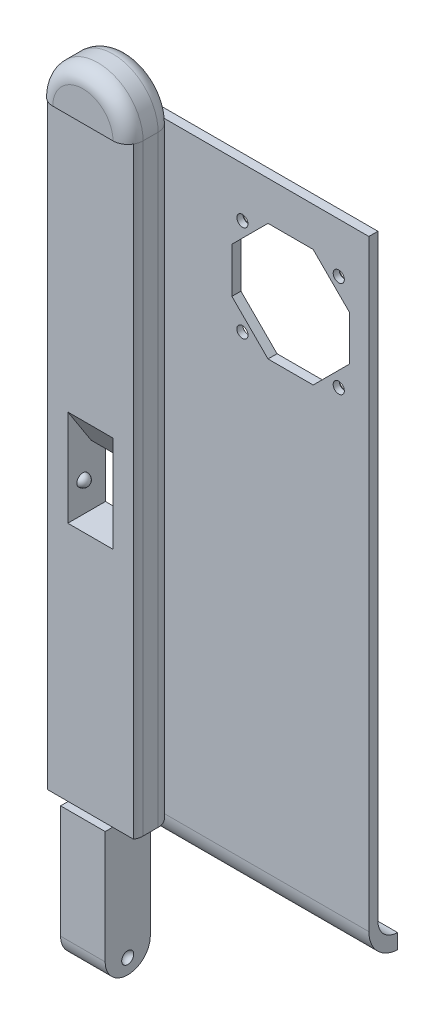
from build123d import *

# Parameters (mm, degrees)
BOSS_EXTRUDE1_DEPTH = 7.5
FILLET1_R           = 5
SKETCH4_W           = 15
SKETCH4_H           = 20
CUT_EXTRUDE1_DEPTH  = 152.492574085
CUT_EXTRUDE2_DEPTH  = 152.848641751
BOSS_EXTRUDE2_DEPTH = 80
BOSS_EXTRUDE3_START = 5
BOSS_EXTRUDE3_DEPTH = 5
SKETCH9_W           = 12.5
SKETCH9_H           = 20
CUT_EXTRUDE3_DEPTH  = 3
SKETCH10_W          = 2.5
SKETCH10_H          = 200
CUT_EXTRUDE4_DEPTH  = 175.180940404
SKETCH11_R          = 1.85
CUT_EXTRUDE5_DEPTH  = 167.580310961
SKETCH12_R          = 3
SKETCH12_R_2        = 3.25
CUT_EXTRUDE6_DEPTH  = 1
CUT_EXTRUDE7_DEPTH  = 7.5


with BuildPart() as part:
    # Sketch1 → Boss-Extrude1 (new, symmetric)
    with BuildSketch(Plane.XY):
        with BuildLine():
            Line((-7.4, -150), (7.4, -150))
            Line((7.4, -150), (7.4, -100))
            Line((7.4, -100), (15, -100))
            Line((15, -100), (15, 100))
            ThreePointArc((15, 100), (0, 115), (-15, 100))
            Line((-15, 100), (-15, -100))
            Line((-15, -100), (-7.4, -100))
            Line((-7.4, -100), (-7.4, -150))
        make_face()
    extrude(amount=BOSS_EXTRUDE1_DEPTH, both=True)

    # Fillet1
    fillet1_edges = [part.edges().sort_by_distance(p)[0] for p in [
        (7.4, -150, 0),
        (-7.4, -150, 0),
        (15, 0, 7.5),
        (0, 115, 7.5),
        (-15, 0, 7.5),
        (-15, 0, -7.5),
        (0, 115, -7.5),
        (15, 0, -7.5),
    ]]
    fillet(fillet1_edges, radius=FILLET1_R)

    # Sketch4 → Cut-Extrude1 (cut, through all)
    with BuildSketch(Plane.XY.offset(7.5)):
        with Locations((0, -10)):
            Rectangle(SKETCH4_W, SKETCH4_H)
    extrude(amount=-CUT_EXTRUDE1_DEPTH, mode=Mode.SUBTRACT)

    # Sketch5 → Revolve2 (revolve)
    with BuildSketch(Plane.XY):
        with BuildLine():
            Line((-7.5, -10), (-5.5, -10))
            ThreePointArc((-5.5, -10), (-6.085786438, -8.585786438), (-7.5, -8))
            Line((-7.5, -8), (-7.5, -10))
        make_face()
        with BuildLine():
            Line((7.5, -10), (5.5, -10))
            ThreePointArc((5.5, -10), (6.085786438, -8.585786438), (7.5, -8))
            Line((7.5, -8), (7.5, -10))
        make_face()
    revolve(axis=Axis((-21.965922243, -10, 0), (1, 0, 0)))

    # Sketch2 → Cut-Revolve1 (revolve, cut)
    with BuildSketch(Plane.XY):
        with BuildLine():
            Line((-7.4, -138), (-7.4, -140))
            Line((-7.4, -140), (-5.4, -140))
            ThreePointArc((-5.4, -140), (-5.985786438, -138.585786438), (-7.4, -138))
        make_face()
        with BuildLine():
            Line((7.4, -138), (7.4, -140))
            Line((7.4, -140), (5.4, -140))
            ThreePointArc((5.4, -140), (5.985786438, -138.585786438), (7.4, -138))
        make_face()
    revolve(axis=Axis((-23.291382295, -140, 0), (1, 0, 0)), mode=Mode.SUBTRACT)

    # Sketch6 → Cut-Extrude2 (cut, through all)
    with BuildSketch(Plane.ZY.offset(7.4)):
        with BuildLine():
            Line((-7.5, -137.5), (-7.5, -150))
            Line((-7.5, -150), (7.5, -150))
            Line((7.5, -150), (7.5, -137.5))
            ThreePointArc((7.5, -137.5), (0, -145), (-7.5, -137.5))
        make_face()
    extrude(amount=-CUT_EXTRUDE2_DEPTH, mode=Mode.SUBTRACT)

    # Sketch3 → Boss-Extrude2 (add)
    with BuildSketch(Plane(origin=(0, 0, 0), x_dir=(0, 0, -1), z_dir=(1, 0, 0))):
        with BuildLine():
            Line((17, -109.987492178), (17, -104.987492178))
            ThreePointArc((17, -104.987492178), (12.403805922, -103.083686255), (10.5, -98.487492178))
            Line((10.5, -98.487492178), (10.5, 100))
            Line((10.5, 100), (7.5, 100))
            Line((7.5, 100), (7.5, -100))
            ThreePointArc((7.5, -100), (10.254311627, -106.892024376), (17, -109.987492178))
        make_face()
    extrude(amount=BOSS_EXTRUDE2_DEPTH)

    # Sketch7 → Boss-Extrude3 (add)
    with BuildSketch(Plane.ZY.offset(BOSS_EXTRUDE3_START)):
        with BuildLine():
            Line((-10.5, 100), (-7.5, 100))
            Line((-7.5, 100), (-7.5, 0))
            Line((-7.5, 0), (-7.5, -20))
            Line((-7.5, -20), (-7.5, -100))
            ThreePointArc((-7.5, -100), (-10.254311627, -106.892024376), (-17, -109.987492178))
            Line((-17, -109.987492178), (-17, -104.987492178))
            ThreePointArc((-17, -104.987492178), (-12.403805922, -103.083686255), (-10.5, -98.487492178))
            Line((-10.5, -98.487492178), (-10.5, 100))
        make_face()
    extrude(amount=-BOSS_EXTRUDE3_DEPTH)

    # Sketch9 → Cut-Extrude3 (cut)
    with BuildSketch(Plane(origin=(0, 0, -10.5), x_dir=(-1, 0, 0), z_dir=(0, 0, -1))):
        with Locations((-1.25, -10)):
            Rectangle(SKETCH9_W, SKETCH9_H)
    extrude(amount=-CUT_EXTRUDE3_DEPTH, mode=Mode.SUBTRACT)

    # Sketch10 → Cut-Extrude4 (cut, through all)
    with BuildSketch(Plane.ZY.offset(15)):
        with Locations((6.25, 0)):
            Rectangle(SKETCH10_W, SKETCH10_H)
    extrude(amount=-CUT_EXTRUDE4_DEPTH, mode=Mode.SUBTRACT)

    # Sketch11 → Cut-Extrude5 (cut, through all)
    with BuildSketch(Plane(origin=(0, 0, -10.5), x_dir=(-1, 0, 0), z_dir=(0, 0, -1))):
        with Locations(Location((-38, 83.512507822, 0), (0, 0, 90))):
            Circle(SKETCH11_R)
        with Locations(Location((-38, 51.512507822, 0), (0, 0, 90))):
            Circle(SKETCH11_R)
        with Locations(Location((-70, 83.512507822, 0), (0, 0, 90))):
            Circle(SKETCH11_R)
        with Locations(Location((-70, 51.512507822, 0), (0, 0, 90))):
            Circle(SKETCH11_R)
        Polygon((-46.5, 87.012507822), (-61.5, 87.012507822), (-73.5, 75.012507822), (-73.5, 60.012507822), (-61.5, 48.012507822), (-46.5, 48.012507822), (-34.5, 60.012507822), (-34.5, 75.012507822), align=None)
    extrude(amount=-CUT_EXTRUDE5_DEPTH, mode=Mode.SUBTRACT)

    # Sketch12 → Cut-Extrude6 (cut)
    with BuildSketch(Plane(origin=(0, 0, -10.5), x_dir=(-1, 0, 0), z_dir=(0, 0, -1))):
        with Locations(Location((-38, 83.512507822, 0), (0, 0, 90))):
            Circle(SKETCH12_R)
        with Locations(Location((-70, 83.512507822, 0), (0, 0, 90))):
            Circle(SKETCH12_R)
        with Locations(Location((-70, 51.512507822, 0), (0, 0, 90))):
            Circle(SKETCH12_R)
        with Locations(Location((-38, 51.512507822, 0), (0, 0, 90))):
            Circle(SKETCH12_R_2)
    extrude(amount=-CUT_EXTRUDE6_DEPTH, mode=Mode.SUBTRACT)

    # Sketch13 → Cut-Extrude7 (cut, symmetric)
    with BuildSketch(Plane(origin=(0, 0, 0), x_dir=(0, 0, -1), z_dir=(1, 0, 0))):
        Polygon((2.75, 0), (-5, 0), (-5, 12), align=None)
    extrude(amount=CUT_EXTRUDE7_DEPTH, both=True, mode=Mode.SUBTRACT)


solid = part.part
